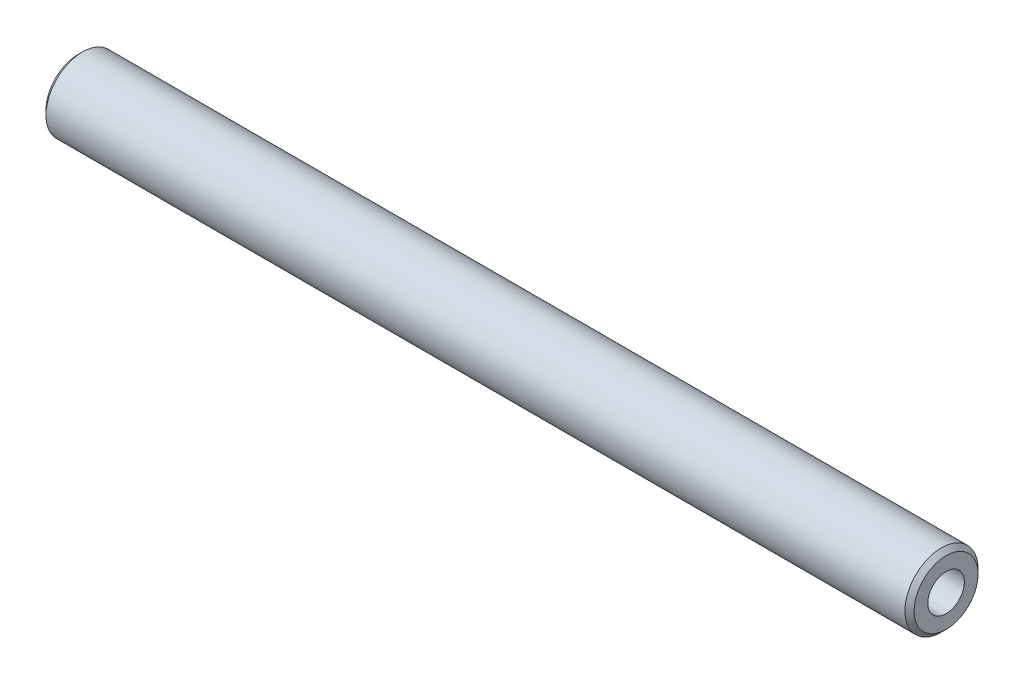
from build123d import *

# Parameters (mm, degrees)
SKETCH_1_W                     = 95
SKETCH_1_H                     = 4
M4X0_7_1_D                     = 3.3
M4X0_7_1_DEPTH                 = 11.5
M4X0_7_1_CBORE_D               = 4
M4X0_7_1_CBORE_DEPTH           = 8
M4X0_7_1_TIP                   = 0.991420021
M4X0_7_1_ON_FACE_2_D           = 3.3
M4X0_7_1_ON_FACE_2_DEPTH       = 11.5
M4X0_7_1_ON_FACE_2_CBORE_D     = 4
M4X0_7_1_ON_FACE_2_CBORE_DEPTH = 8
M4X0_7_1_ON_FACE_2_TIP         = 0.991420021
CHAMFER_1_SIZE                 = 0.5


with BuildPart() as part:
    # ｽｹｯﾁ1 → 回転1 (revolve)
    with BuildSketch(Plane.XY, mode=Mode.PRIVATE) as revolve_1_sk:
        with Locations((0, 2)):
            Rectangle(SKETCH_1_W, SKETCH_1_H)
    revolve(revolve_1_sk.sketch.rotate(Axis((0, 0, 0), (1, 0, 0)), 90), axis=Axis((0, 0, 0), (1, 0, 0)))

    # M4x0.7 ねじ穴1
    with Locations(Plane(origin=(47.5, 0, 0), x_dir=(0, 0, 1), z_dir=(1, 0, 0))):
        with Locations((0, 0)):
            CounterBoreHole(M4X0_7_1_D / 2, M4X0_7_1_CBORE_D / 2, M4X0_7_1_CBORE_DEPTH, depth=M4X0_7_1_DEPTH)
            with Locations((0, 0, -(M4X0_7_1_DEPTH + M4X0_7_1_TIP / 2))):  # 118° drill point
                Cone(0, M4X0_7_1_D / 2, M4X0_7_1_TIP, mode=Mode.SUBTRACT)

    # M4x0.7 ねじ穴1 on face 2
    with Locations(Plane(origin=(-47.5, 0, 0), x_dir=(0, 0, -1), z_dir=(-1, 0, 0))):
        with Locations((0, 0)):
            CounterBoreHole(M4X0_7_1_ON_FACE_2_D / 2, M4X0_7_1_ON_FACE_2_CBORE_D / 2, M4X0_7_1_ON_FACE_2_CBORE_DEPTH, depth=M4X0_7_1_ON_FACE_2_DEPTH)
            with Locations((0, 0, -(M4X0_7_1_ON_FACE_2_DEPTH + M4X0_7_1_ON_FACE_2_TIP / 2))):  # 118° drill point
                Cone(0, M4X0_7_1_ON_FACE_2_D / 2, M4X0_7_1_ON_FACE_2_TIP, mode=Mode.SUBTRACT)

    # 面取り1
    chamfer_1_edges = [part.edges().sort_by_distance(p)[0] for p in [
        (47.5, 0, -4),
        (-47.5, 0, -4),
    ]]
    chamfer(chamfer_1_edges, length=CHAMFER_1_SIZE)


solid = part.part
